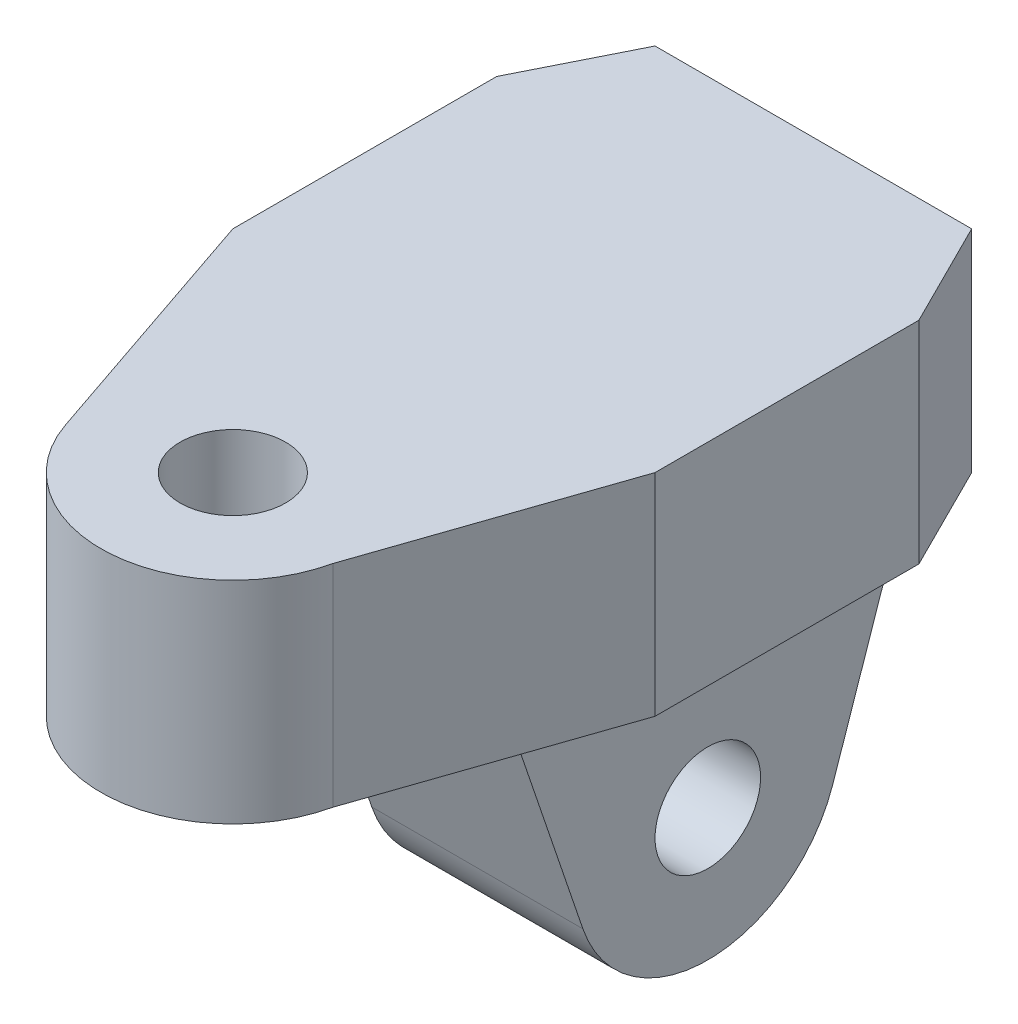
from build123d import *

# Parameters (mm, degrees)
SKETCH_1_R      = 3
EXTRUDE_1_DEPTH = 6
SKETCH_2_R      = 3
EXTRUDE_2_DEPTH = 12
EXTRUDE_3_DEPTH = 3
EXTRUDE_4_DEPTH = 12
EXTRUDE_5_DEPTH = 12


with BuildPart() as part:
    # 스케치1 → 보스-돌출1 (new, symmetric)
    with BuildSketch(Plane(origin=(0, 0, 0), x_dir=(0, 0, -1), z_dir=(1, 0, 0))):
        with BuildLine():
            Line((-12, 12), (12, 12))
            Line((12, 12), (7.101042921, -2.413542921))
            ThreePointArc((7.101042921, -2.413542921), (0, -7.5), (-7.101042921, -2.413542921))
            Line((-7.101042921, -2.413542921), (-12, 12))
        make_face()
        Circle(SKETCH_1_R, mode=Mode.SUBTRACT)
    extrude(amount=EXTRUDE_1_DEPTH, both=True)

    # 스케치2 → 보스-돌출2 (add)
    with BuildSketch(Plane(origin=(0, 12, 0), x_dir=(1, 0, 0), z_dir=(0, 1, 0))):
        with BuildLine():
            Line((-12, -9), (12, -9))
            Line((12, -9), (7.319153043, -22.637070166))
            ThreePointArc((7.319153043, -22.637070166), (0.403262311, -28.489150787), (-7.101042921, -23.413542921))
            Line((-7.101042921, -23.413542921), (-12, -9))
        make_face()
        with Locations(Location((0, -21, 0), (0, 0, 270))):
            Circle(SKETCH_2_R, mode=Mode.SUBTRACT)
    extrude(amount=EXTRUDE_2_DEPTH)

    # 스케치3 → 보스-돌출3 (add)
    with BuildSketch(Plane(origin=(0, 0, 9), x_dir=(-1, 0, 0), z_dir=(0, 0, -1))):
        Polygon((-12, 12), (-6, 12), (6, 12), (12, 12), (12, 24), (-12, 24), align=None)
    extrude(amount=EXTRUDE_3_DEPTH)

    # 스케치4 → 보스-돌출4 (add)
    with BuildSketch(Plane(origin=(0, 0, 6), x_dir=(-1, 0, 0), z_dir=(0, 0, -1))):
        Polygon((-9, 12), (-6, 9), (-6, 12), (6, 12), (6, 9), (9, 12), (12, 12), (12, 24), (-12, 24), (-12, 12), align=None)
    extrude(amount=EXTRUDE_4_DEPTH)

    # 스케치5 → 보스-돌출5 (add)
    with BuildSketch(Plane(origin=(0, 12, 0), x_dir=(1, 0, 0), z_dir=(0, 1, 0))):
        Polygon((-12, 6), (12, 6), (9, 12), (-9, 12), align=None)
    extrude(amount=EXTRUDE_5_DEPTH)


solid = part.part
